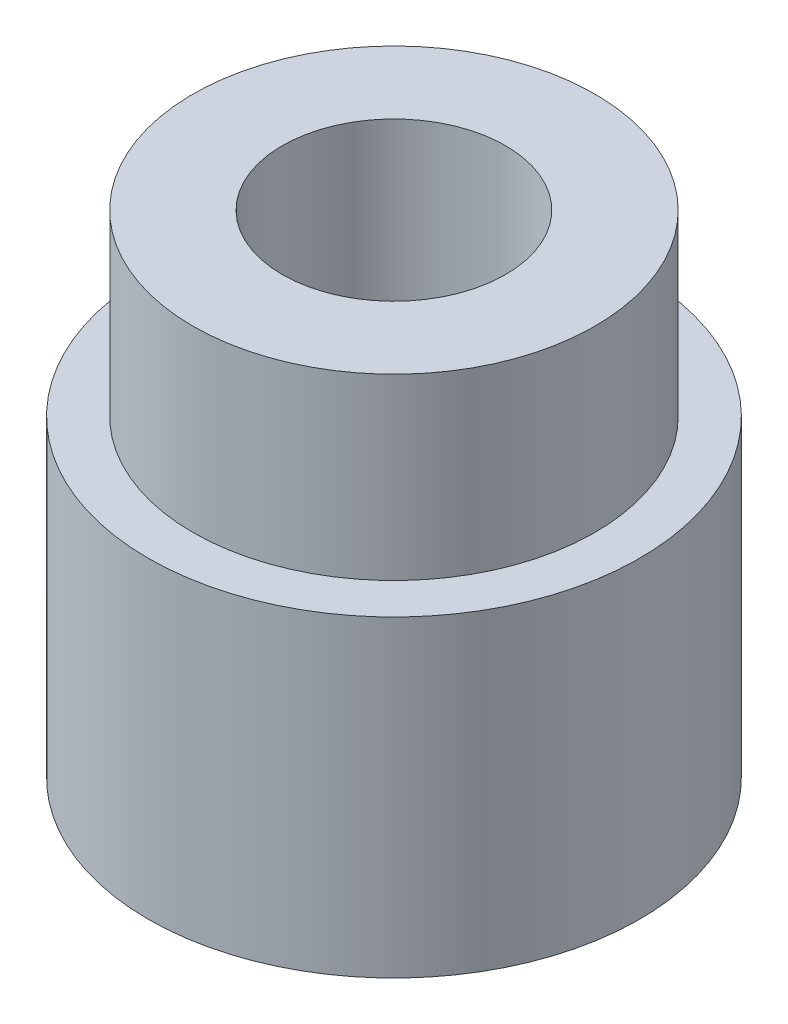
from build123d import *

# Parameters (mm, degrees)
ESQUISSE1_R             = 5.5
BOSS_EXTRU_1_DEPTH      = 7
ESQUISSE9_R             = 4.5
BOSS_EXTRU_3_DEPTH      = 4
ESQUISSE10_R            = 2.5
ENL_V_MAT_EXTRU_4_DEPTH = 11


with BuildPart() as part:
    # Esquisse1 → Boss.-Extru.1 (new body)
    with BuildSketch(Plane(origin=(0, 0, 0), x_dir=(1, 0, 0), z_dir=(0, 1, 0))):
        with Locations(Location((0, 0, 0), (0, 0, 270))):
            Circle(ESQUISSE1_R)
    extrude(amount=BOSS_EXTRU_1_DEPTH)

    # Esquisse9 → Boss.-Extru.3 (add)
    with BuildSketch(Plane(origin=(0, 7, 0), x_dir=(1, 0, 0), z_dir=(0, 1, 0))):
        with Locations(Location((0, 0, 0), (0, 0, 270))):
            Circle(ESQUISSE9_R)
    extrude(amount=BOSS_EXTRU_3_DEPTH)

    # Esquisse10 → Enlèv. mat.-Extru.4 (cut)
    with BuildSketch(Plane(origin=(0, 11, 0), x_dir=(1, 0, 0), z_dir=(0, 1, 0))):
        with Locations(Location((0, 0, 0), (0, 0, 270))):
            Circle(ESQUISSE10_R)
    extrude(amount=-ENL_V_MAT_EXTRU_4_DEPTH, mode=Mode.SUBTRACT)


solid = part.part
